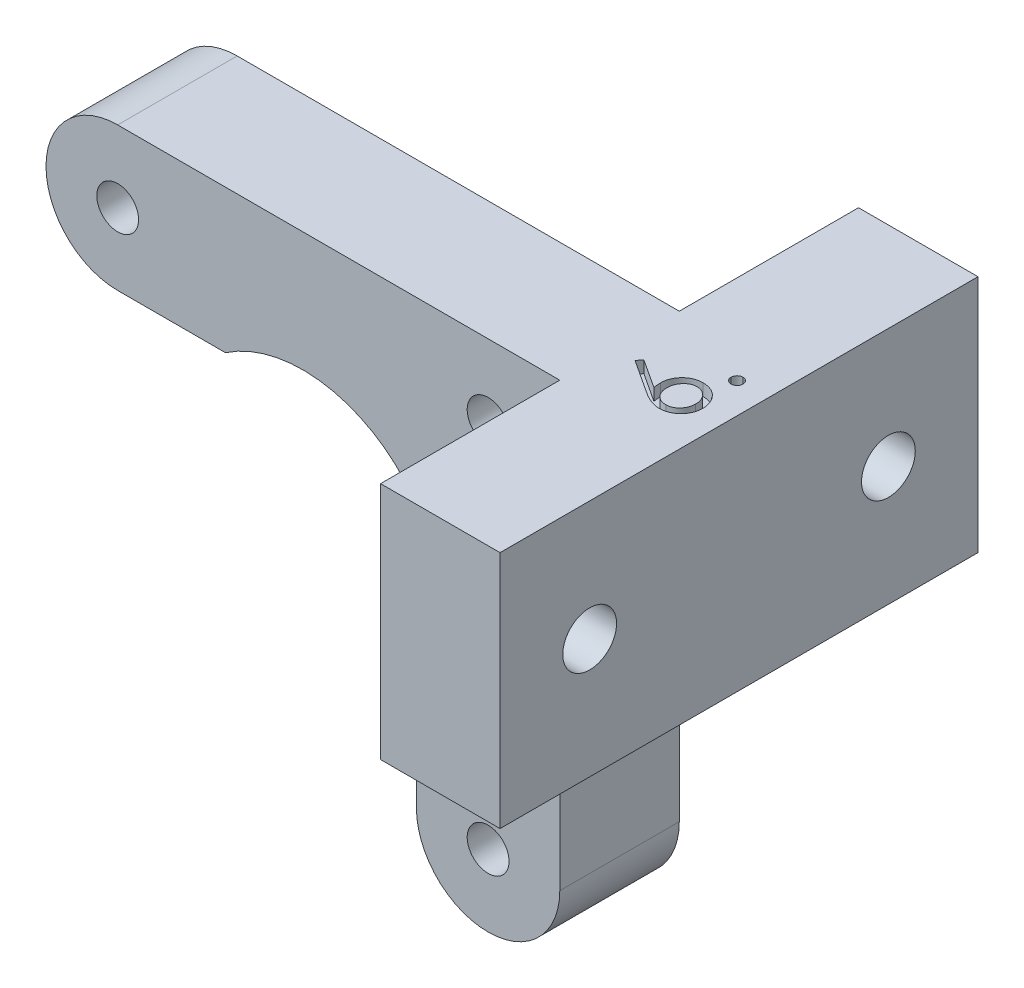
from build123d import *

# Parameters (mm, degrees)
CROQUIS1_R              = 1.75
SALIENTE_EXTRUIR1_DEPTH = 10
CROQUIS3_W              = 40
CROQUIS3_H              = 20
SALIENTE_EXTRUIR2_DEPTH = 10
CROQUIS4_R              = 2.25
CORTAR_EXTRUIR2_DEPTH   = 10
CORTAR_EXTRUIR3_DEPTH   = 1
CROQUIS6_R              = 3.6
CORTAR_EXTRUIR4_DEPTH   = 4.3


with BuildPart() as part:
    # Croquis1 → Saliente-Extruir1 (new body)
    with BuildSketch(Plane.XY):
        with BuildLine():
            Line((0, 6), (31, 6))
            Line((31, 6), (37, 6))
            Line((37, 6), (37, 0))
            Line((37, 0), (37, -31))
            ThreePointArc((37, -31), (31, -37), (25, -31))
            Line((25, -31), (25, -21.980740698))
            ThreePointArc((25, -21.980740698), (23.631727984, -7.368272016), (9.019259302, -6))
            Line((9.019259302, -6), (0, -6))
            ThreePointArc((0, -6), (-6, 0), (0, 6))
        make_face()
        Circle(CROQUIS1_R, mode=Mode.SUBTRACT)
        with Locations((31, 0)):
            Circle(CROQUIS1_R, mode=Mode.SUBTRACT)
        with Locations((31, -31)):
            Circle(CROQUIS1_R, mode=Mode.SUBTRACT)
    extrude(amount=SALIENTE_EXTRUIR1_DEPTH)

    # Croquis3 → Saliente-Extruir2 (add)
    with BuildSketch(Plane(origin=(37, 0, 0), x_dir=(0, 0, -1), z_dir=(1, 0, 0))):
        with Locations((-5, -4)):
            Rectangle(CROQUIS3_W, CROQUIS3_H)
    extrude(amount=SALIENTE_EXTRUIR2_DEPTH)

    # Croquis4 → Cortar-Extruir2 (cut)
    with BuildSketch(Plane(origin=(47, 0, 0), x_dir=(0, 0, -1), z_dir=(1, 0, 0))):
        with Locations((-17.5, -4)):
            Circle(CROQUIS4_R)
        with Locations((7.5, -4)):
            Circle(CROQUIS4_R)
    extrude(amount=-CORTAR_EXTRUIR2_DEPTH, mode=Mode.SUBTRACT)

    # Croquis5 → Cortar-Extruir3 (cut)
    # profile 1 of 2: a face of its own
    with BuildSketch(Plane(origin=(0, 6, 0), x_dir=(1, 0, 0), z_dir=(0, 1, 0))):
        with BuildLine():
            Line((38.719450651, -5.423076923), (39.045171805, -5.008413462))
            Line((39.045171805, -5.008413462), (41.469450651, -6.59375))
            add(Edge.make_bspline(
                [(41.469450651, -6.59375), (41.45262689, -6.488200954), (41.419810241, -6.282315605), (41.414396621, -6.073916922), (41.411758343, -5.972355769)],
                knots=[0, 0, 0, 0, 1.025318673, 2, 2, 2, 2], degree=3))
            add(Edge.make_bspline(
                [(41.411758343, -5.972355769), (41.413397392, -5.911374347), (41.41662381, -5.791334232), (41.441453269, -5.615094001), (41.48058203, -5.445741533), (41.537620193, -5.283978793), (41.610481332, -5.12922502), (41.69780526, -4.98059268), (41.804100137, -4.84087365), (41.922842279, -4.708276629), (42.054348853, -4.587868709), (42.193923862, -4.481348491), (42.341556266, -4.391383269), (42.497212867, -4.319707477), (42.659675206, -4.262425826), (42.829576898, -4.221648263), (43.0072047, -4.197270821), (43.128028028, -4.193979555), (43.189402574, -4.192307692)],
                knots=[0, 0, 0, 0, 1.043709831, 2.054511743, 3.041122595, 4.01515914, 4.98481438, 5.965901842, 6.960491961, 7.985277438, 9.0096037, 10.00832444, 10.987059228, 11.962929573, 12.936966118, 13.931840027, 14.949438142, 16, 16, 16, 16], degree=3))
            add(Edge.make_bspline(
                [(43.189402574, -4.192307692), (43.273370923, -4.194741372), (43.438600762, -4.199530277), (43.679201656, -4.247450052), (43.908280527, -4.321356873), (44.121873475, -4.428685672), (44.321459866, -4.559473328), (44.497723912, -4.720926587), (44.654923346, -4.905035031), (44.786320549, -5.113320498), (44.893643904, -5.337445219), (44.970726157, -5.572907398), (45.018183801, -5.817410653), (45.024133369, -5.983361467), (45.027142959, -6.067307692)],
                knots=[0, 0, 0, 0, 1.031403119, 2.029557249, 3.004870281, 3.983165322, 4.960181699, 5.929903783, 6.912123683, 7.928973898, 8.949315281, 9.960468141, 10.968302741, 12, 12, 12, 12], degree=3))
            add(Edge.make_bspline(
                [(45.027142959, -6.067307692), (45.024530622, -6.148048292), (45.019356041, -6.307981282), (44.973019832, -6.5431878), (44.898450918, -6.769592811), (44.79356478, -6.984290092), (44.66331814, -7.183504791), (44.507611369, -7.363156395), (44.32622815, -7.5184301), (44.123136349, -7.648813278), (43.905204402, -7.75266345), (43.677571617, -7.829814545), (43.441193643, -7.875117968), (43.280937295, -7.881434097), (43.200219882, -7.884615385)],
                knots=[0, 0, 0, 0, 1.012172929, 2.004937354, 2.995255351, 3.995689452, 4.993936421, 5.973737378, 6.968231049, 7.979117505, 8.993136101, 9.989812463, 10.987515067, 12, 12, 12, 12], degree=3))
            add(Edge.make_bspline(
                [(43.200219882, -7.884615385), (43.138429168, -7.88259005), (43.012264336, -7.878454705), (42.821183145, -7.849580321), (42.625667005, -7.80318353), (42.459802673, -7.751223108), (42.323925778, -7.696322062), (42.214376937, -7.650631994), (42.101643669, -7.593762287), (41.981860293, -7.533122205), (41.858113837, -7.463253287), (41.728336117, -7.387283602), (41.594591099, -7.303112772), (41.503829621, -7.244106778), (41.45743142, -7.213942308)],
                knots=[0, 0, 0, 0, 1.173818275, 2.396712641, 3.66331629, 4.989737886, 5.693666774, 6.447286557, 7.243889047, 8.091586357, 8.998013824, 9.943181721, 10.948533338, 12, 12, 12, 12], degree=3))
            Line((41.45743142, -7.213942308), (38.719450651, -5.423076923))
        make_face()
        with BuildLine():
            add(Edge.make_bspline(
                [(42.027142959, -6.085336538), (42.028463871, -6.131047697), (42.031043996, -6.220334868), (42.046353115, -6.351256722), (42.074217455, -6.47556773), (42.112853793, -6.593303975), (42.160487874, -6.705191769), (42.221606583, -6.809013804), (42.29279593, -6.906906504), (42.373927128, -6.997305799), (42.462694986, -7.079287189), (42.557788622, -7.149882157), (42.656897901, -7.210778026), (42.760855723, -7.260289629), (42.869621095, -7.298844068), (42.982694109, -7.326732492), (43.100832915, -7.34225321), (43.180945778, -7.344835321), (43.221854497, -7.346153846)],
                knots=[0, 0, 0, 0, 1.129656352, 2.206547016, 3.251334079, 4.271920891, 5.265058649, 6.249872215, 7.241923875, 8.251504132, 9.246416584, 10.222533834, 11.173322129, 12.116503788, 13.062124155, 14.020151864, 14.989013135, 16, 16, 16, 16], degree=3))
            add(Edge.make_bspline(
                [(43.221854497, -7.346153846), (43.262390236, -7.345042059), (43.342270883, -7.342851147), (43.459527516, -7.324197734), (43.572108371, -7.294382199), (43.679590351, -7.251311648), (43.784036826, -7.19897235), (43.882187361, -7.131790832), (43.97722126, -7.054685968), (44.064722932, -6.964658995), (44.145955918, -6.8673042), (44.217253031, -6.763510182), (44.277542135, -6.654839733), (44.327498317, -6.541605832), (44.364273193, -6.422408765), (44.39242636, -6.29918399), (44.407818081, -6.170256123), (44.410427684, -6.082969666), (44.411758343, -6.038461538)],
                knots=[0, 0, 0, 0, 0.989367052, 1.949669134, 2.891858276, 3.827522767, 4.772653562, 5.738670152, 6.725809442, 7.756636004, 8.798867547, 9.819240912, 10.826537776, 11.829883227, 12.835515726, 13.868058748, 14.912904531, 16, 16, 16, 16], degree=3))
            add(Edge.make_bspline(
                [(44.411758343, -6.038461538), (44.41042758, -5.993953484), (44.407817774, -5.90666717), (44.392427526, -5.777738265), (44.364268919, -5.654517323), (44.327513802, -5.535306334), (44.277484342, -5.422124068), (44.217630322, -5.313548608), (44.145518764, -5.210736256), (44.064862408, -5.113318104), (43.976721258, -5.02366527), (43.883043664, -4.944746981), (43.783251472, -4.879664359), (43.680001032, -4.825249844), (43.572044173, -4.782656193), (43.459545037, -4.752693871), (43.342266312, -4.73408014), (43.262388698, -4.731883781), (43.221854497, -4.730769231)],
                knots=[0, 0, 0, 0, 1.087281468, 2.132306021, 3.165025708, 4.170830268, 5.174347389, 6.181816599, 7.194310624, 8.23672049, 9.267723423, 10.261267456, 11.222032883, 12.171822355, 13.107646935, 14.049997283, 15.01046367, 16, 16, 16, 16], degree=3))
            add(Edge.make_bspline(
                [(43.221854497, -4.730769231), (43.180892409, -4.73171259), (43.100497153, -4.733564098), (42.982746954, -4.754505725), (42.869046586, -4.783549789), (42.760110728, -4.827406434), (42.656368933, -4.884383287), (42.557298409, -4.953783726), (42.462134709, -5.034066908), (42.373753422, -5.126810316), (42.292883888, -5.227746884), (42.22170449, -5.335154265), (42.160945465, -5.447073949), (42.113001784, -5.565082488), (42.074377809, -5.687592088), (42.046452462, -5.815448694), (42.031083903, -5.948743241), (42.028473339, -6.039225506), (42.027142959, -6.085336538)],
                knots=[0, 0, 0, 0, 0.978259475, 1.920005202, 2.851759169, 3.7803069, 4.719124913, 5.675758531, 6.668034766, 7.691045932, 8.733780038, 9.756656648, 10.768121246, 11.773215211, 12.79725739, 13.836288844, 14.897342417, 16, 16, 16, 16], degree=3))
        make_face(mode=Mode.SUBTRACT)
    # profile 2 of 2: a face of its own
    with BuildSketch(Plane(origin=(0, 6, 0), x_dir=(1, 0, 0), z_dir=(0, 1, 0))):
        with BuildLine():
            add(Edge.make_bspline(
                [(43.950219882, -2.615384615), (43.95220531, -2.581972823), (43.956097511, -2.51647291), (43.98280038, -2.421777262), (44.030215227, -2.336072131), (44.093408561, -2.25973114), (44.170029698, -2.196805752), (44.255051256, -2.147701148), (44.3505397, -2.121230888), (44.416419143, -2.117367039), (44.450219882, -2.115384615)],
                knots=[0, 0, 0, 0, 1.020151414, 1.999887582, 2.974338812, 3.990962822, 5.007586832, 5.987933904, 6.967670073, 8, 8, 8, 8], degree=3))
            add(Edge.make_bspline(
                [(44.450219882, -2.115384615), (44.48321411, -2.117427904), (44.548278244, -2.121457239), (44.642964488, -2.147713091), (44.728083557, -2.196746141), (44.804525099, -2.260131503), (44.869244769, -2.335615588), (44.916031001, -2.422045399), (44.944737682, -2.516233448), (44.948370129, -2.581929945), (44.950219882, -2.615384615)],
                knots=[0, 0, 0, 0, 1.009624703, 1.990965087, 2.972917375, 3.991206001, 5.017354006, 5.993400798, 6.978178195, 8, 8, 8, 8], degree=3))
            add(Edge.make_bspline(
                [(44.950219882, -2.615384615), (44.948437276, -2.648863379), (44.944957162, -2.714222696), (44.915444253, -2.80805959), (44.869691223, -2.895016193), (44.804407281, -2.970480663), (44.728478959, -3.034379676), (44.642378281, -3.081237346), (44.548549602, -3.109769691), (44.483267561, -3.113497493), (44.450219882, -3.115384615)],
                knots=[0, 0, 0, 0, 1.022258411, 1.995716197, 2.98297171, 4.009558169, 5.028281891, 6.00474573, 6.989943903, 8, 8, 8, 8], degree=3))
            add(Edge.make_bspline(
                [(44.450219882, -3.115384615), (44.416363802, -3.113563874), (44.350263962, -3.110009099), (44.255636921, -3.081250825), (44.169633882, -3.034320176), (44.093525459, -2.970882356), (44.029775797, -2.894554991), (43.983379009, -2.808332925), (43.95588116, -2.713979428), (43.952139702, -2.648819533), (43.950219882, -2.615384615)],
                knots=[0, 0, 0, 0, 1.032775665, 2.016367738, 2.991239715, 4.008302682, 5.025365648, 6.011011707, 6.979408107, 8, 8, 8, 8], degree=3))
        make_face()
    extrude(amount=-CORTAR_EXTRUIR3_DEPTH, mode=Mode.SUBTRACT)

    # Croquis6 → Cortar-Extruir4 (cut)
    with BuildSketch(Plane.ZY.offset(-37)):
        with Locations((-7.5, -4)):
            Circle(CROQUIS6_R)
    extrude(amount=-CORTAR_EXTRUIR4_DEPTH, mode=Mode.SUBTRACT)


solid = part.part
